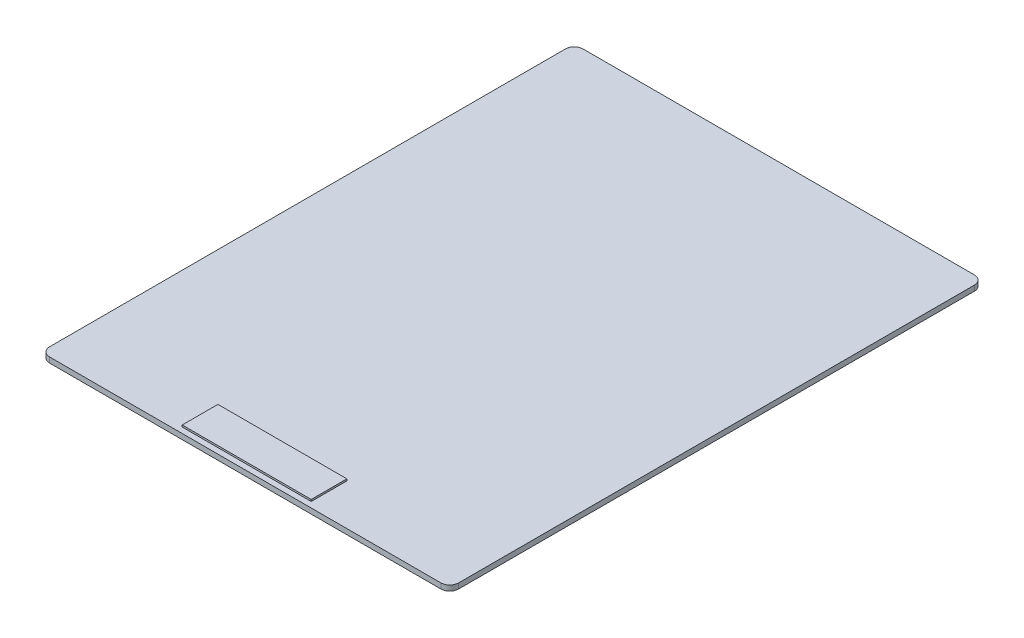
from build123d import *

# Parameters (mm, degrees)
SKETCH1_W           = 230
SKETCH1_H           = 300
BOSS_EXTRUDE1_DEPTH = 3
FILLET1_R           = 5
SKETCH2_W           = 72.53015036
SKETCH2_H           = 20.073618637
BOSS_EXTRUDE2_DEPTH = 1


with BuildPart() as part:
    # Sketch1 → Boss-Extrude1 (new body)
    with BuildSketch(Plane(origin=(0, 0, 0), x_dir=(1, 0, 0), z_dir=(0, 1, 0))):
        with Locations((439.297793407, 824.401400972)):
            Rectangle(SKETCH1_W, SKETCH1_H)
    extrude(amount=BOSS_EXTRUDE1_DEPTH)

    # Fillet1
    fillet1_edges = [part.edges().sort_by_distance(p)[0] for p in [
        (554.297793407, 1.5, -674.401400972),
        (324.297793407, 1.5, -674.401400972),
        (324.297793407, 1.5, -974.401400972),
        (554.297793407, 1.5, -974.401400972),
    ]]
    fillet(fillet1_edges, radius=FILLET1_R)

    # Sketch2 → Boss-Extrude2 (add)
    with BuildSketch(Plane(origin=(0, 3, 0), x_dir=(1, 0, 0), z_dir=(0, 1, 0))):
        with Locations((436.94953533, 687.595411645)):
            Rectangle(SKETCH2_W, SKETCH2_H)
    extrude(amount=BOSS_EXTRUDE2_DEPTH)


solid = part.part
